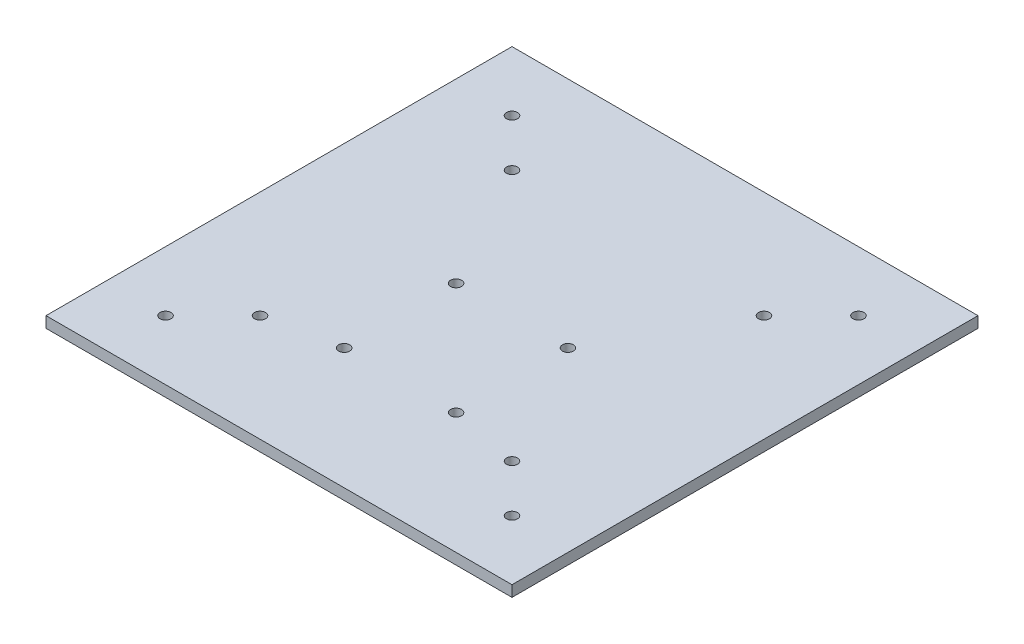
from build123d import *

# Parameters (mm, degrees)
SKETCH2_W               = 127
SKETCH2_H               = 127
BOSS_EXTRUDE1_DEPTH     = 3
CUT_EXTRUDE1_DEPTH      = 90.852657167
CUT_EXTRUDE1_DEPTH_BACK = 90.852657167
SKETCH3_R               = 1.5
SKETCH4_R               = 1.5
CUT_EXTRUDE2_DEPTH      = 10


with BuildPart() as part:
    # Sketch2 → Boss-Extrude1 (new body)
    with BuildSketch(Plane(origin=(0, 0, 0), x_dir=(1, 0, 0), z_dir=(0, 1, 0))):
        Rectangle(SKETCH2_W, SKETCH2_H)
    extrude(amount=BOSS_EXTRUDE1_DEPTH)

    # Sketch3 → Cut-Extrude1 (cut, two sides: drawn at the far end of the back side and taken through both)
    with BuildSketch(Plane(origin=(0, 3, 0), x_dir=(1, 0, 0), z_dir=(0, 1, 0)).offset(-CUT_EXTRUDE1_DEPTH_BACK)):
        with Locations(Location((-47.214690182, 47.214690182, 0), (0, 0, 270))):
            Circle(SKETCH3_R)
        with Locations(Location((-34.337144063, 34.337144063, 0), (0, 0, 270))):
            Circle(SKETCH3_R)
        with Locations(Location((47.214690182, 47.214690182, 0), (0, 0, 270))):
            Circle(SKETCH3_R)
        with Locations(Location((34.337144063, 34.337144063, 0), (0, 0, 270))):
            Circle(SKETCH3_R)
        with Locations(Location((47.214690182, -47.214690182, 0), (0, 0, 270))):
            Circle(SKETCH3_R)
        with Locations(Location((34.337144063, -34.337144063, 0), (0, 0, 270))):
            Circle(SKETCH3_R)
        with Locations(Location((-47.214690182, -47.214690182, 0), (0, 0, 270))):
            Circle(SKETCH3_R)
        with Locations(Location((-34.337144063, -34.337144063, 0), (0, 0, 270))):
            Circle(SKETCH3_R)
    extrude(amount=CUT_EXTRUDE1_DEPTH + CUT_EXTRUDE1_DEPTH_BACK, mode=Mode.SUBTRACT)

    # Sketch4 → Cut-Extrude2 (cut)
    with BuildSketch(Plane(origin=(0, 3, 0), x_dir=(1, 0, 0), z_dir=(0, 1, 0))):
        with Locations(Location((-15.25, 0, 0), (0, 0, 270))):
            Circle(SKETCH4_R)
        with Locations(Location((15.25, 0, 0), (0, 0, 270))):
            Circle(SKETCH4_R)
        with Locations(Location((-15.25, -30.5, 0), (0, 0, 270))):
            Circle(SKETCH4_R)
        with Locations(Location((15.25, -30.5, 0), (0, 0, 270))):
            Circle(SKETCH4_R)
    extrude(amount=-CUT_EXTRUDE2_DEPTH, mode=Mode.SUBTRACT)


solid = part.part
